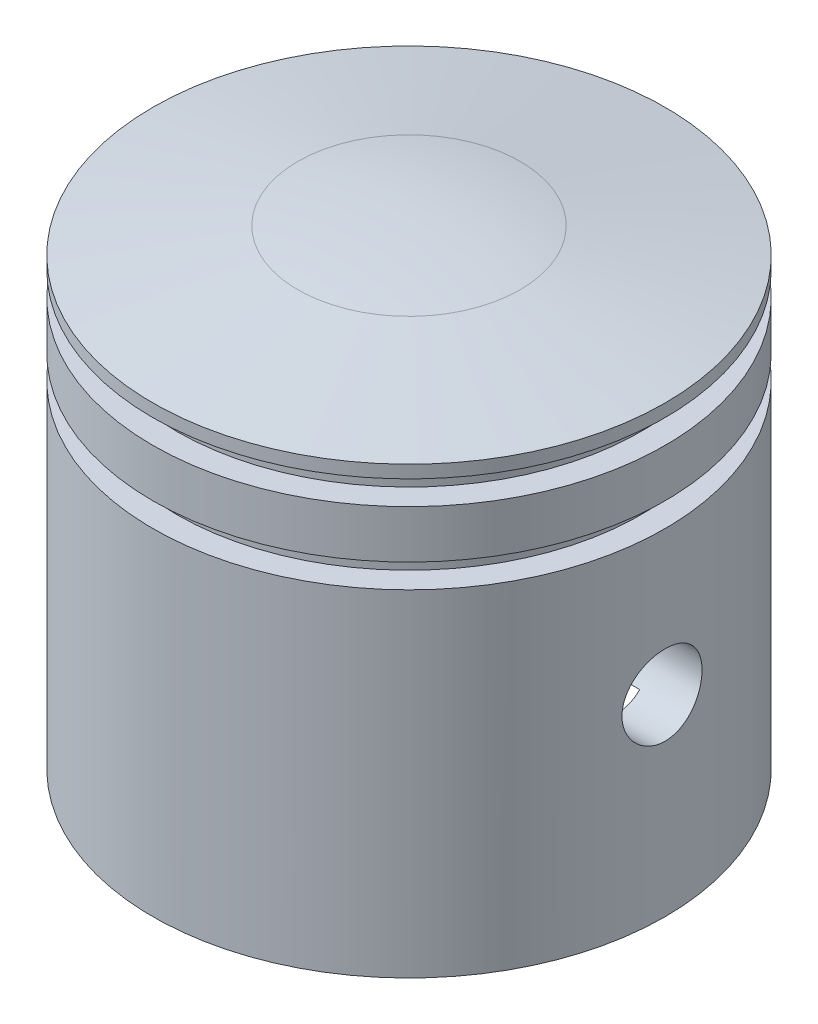
from build123d import *

# Parameters (mm, degrees)
SKETCH2_W               = 3.38439516
SKETCH2_H               = 1.5
SKETCH3_R               = 10
CUT_EXTRUDE1_DEPTH      = 24
SKETCH4_R               = 13
CUT_EXTRUDE2_DEPTH      = 10
CUT_EXTRUDE3_DEPTH      = 38.576588456
CUT_EXTRUDE3_DEPTH_BACK = 38.576588456
SKETCH5_R               = 2.5


with BuildPart() as part:
    # Sketch1 → Revolve1 (revolve)
    with BuildSketch(Plane.XY, mode=Mode.PRIVATE) as revolve1_sk:
        with BuildLine():
            Line((0, 0), (16, 0))
            Line((16, 0), (16, 27.795832784))
            Line((16, 27.795832784), (6.945927107, 29.39231012))
            ThreePointArc((6.945927107, 29.39231012), (3.48622971, 29.847787924), (0, 30))
            Line((0, 30), (0, 0))
        make_face()
    revolve(revolve1_sk.sketch.rotate(Axis((0, 30, 0), (0, -1, 0)), 180), axis=Axis((0, 30, 0), (0, -1, 0)))

    # Sketch2 → Cut-Revolve1 (revolve, cut)
    with BuildSketch(Plane.XY, mode=Mode.PRIVATE) as cut_revolve1_sk:
        with Locations((16.19219758, 26.25)):
            Rectangle(SKETCH2_W, SKETCH2_H)
        with Locations((16.19219758, 21.75)):
            Rectangle(SKETCH2_W, SKETCH2_H)
    revolve(cut_revolve1_sk.sketch.rotate(Axis((0, 0, 0), (0, 1, 0)), 90), axis=Axis((0, 0, 0), (0, 1, 0)), mode=Mode.SUBTRACT)

    # Sketch3 → Cut-Extrude1 (cut)
    with BuildSketch(Plane.XZ):
        Circle(SKETCH3_R)
    extrude(amount=-CUT_EXTRUDE1_DEPTH, mode=Mode.SUBTRACT)

    # Sketch4 → Cut-Extrude2 (cut)
    with BuildSketch(Plane.XZ):
        Circle(SKETCH4_R)
    extrude(amount=-CUT_EXTRUDE2_DEPTH, mode=Mode.SUBTRACT)

    # Sketch5 → Cut-Extrude3 (cut, two sides: drawn at the far end of the back side and taken through both)
    with BuildSketch(Plane(origin=(0, 0, 0), x_dir=(0, 0, -1), z_dir=(1, 0, 0)).offset(-CUT_EXTRUDE3_DEPTH_BACK)):
        with Locations(Location((0, 12, 0), (0, 0, 306.869897646))):
            Circle(SKETCH5_R)
    extrude(amount=CUT_EXTRUDE3_DEPTH + CUT_EXTRUDE3_DEPTH_BACK, mode=Mode.SUBTRACT)


solid = part.part
